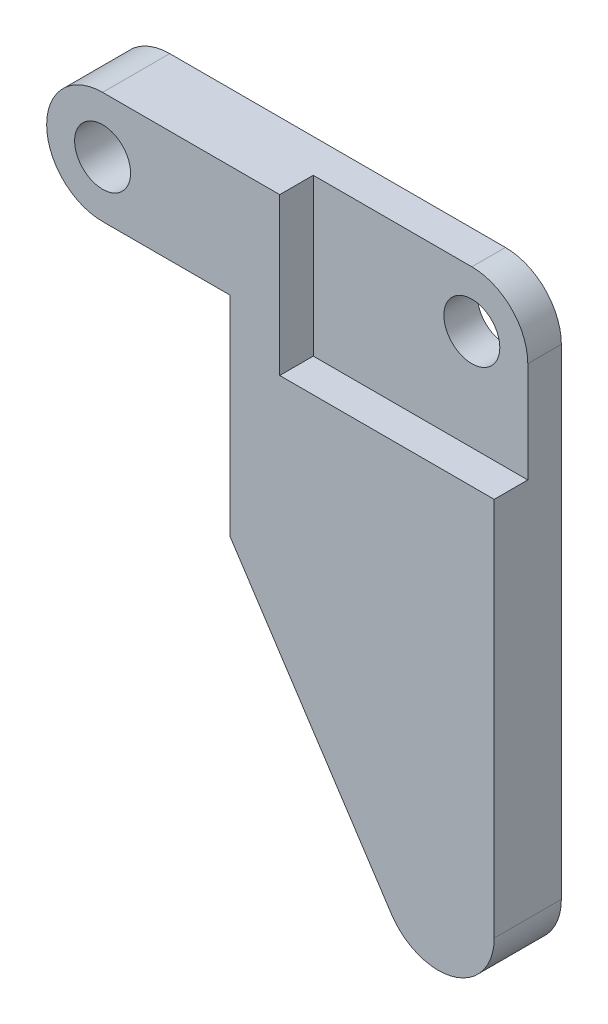
from build123d import *

# Parameters (mm, degrees)
SKETCH1_R               = 2.5
BOSS_EXTRUDE1_DEPTH     = 6
CUT_EXTRUDE1_DEPTH      = 60.673537378
CUT_EXTRUDE1_DEPTH_BACK = 3
SKETCH2_R               = 2.5


with BuildPart() as part:
    # Sketch1 → Boss-Extrude1 (new body)
    # profile 1 of 2: a face of its own
    with BuildSketch(Plane.XY):
        with BuildLine():
            ThreePointArc((30, -5), (35, 0), (30, 5))
            Line((30, 5), (0, 5))
            ThreePointArc((0, 5), (-5, 0), (0, -5))
            Line((0, -5), (30, -5))
        make_face()
        with Locations((30, 0)):
            Circle(SKETCH1_R, mode=Mode.SUBTRACT)
        Circle(SKETCH1_R, mode=Mode.SUBTRACT)
    # profile 2 of 2: a face of its own
    with BuildSketch(Plane.XY):
        with BuildLine():
            Line((35, -42.957596512), (35, 0))
            ThreePointArc((35, 0), (33.535533906, -3.535533906), (30, -5))
            Line((30, -5), (11.394465816, -5))
            Line((11.394465816, -5), (11.394465816, -23.685159648))
            Line((11.394465816, -23.685159648), (25.817798964, -45.697887462))
            ThreePointArc((25.817798964, -45.697887462), (31.429859227, -47.748786613), (35, -42.957596512))
        make_face()
    extrude(amount=BOSS_EXTRUDE1_DEPTH)

    # Sketch2 → Cut-Extrude1 (cut, two sides: drawn at the far end of the back side and taken through both)
    with BuildSketch(Plane.XY.offset(6).offset(-CUT_EXTRUDE1_DEPTH_BACK)):
        with BuildLine():
            Line((30, 5), (15.828754387, 5))
            Line((15.828754387, 5), (15.828754387, -8.999149352))
            Line((15.828754387, -8.999149352), (35, -8.999149352))
            Line((35, -8.999149352), (35, 0))
            ThreePointArc((35, 0), (33.535533906, 3.535533906), (30, 5))
        make_face()
        with Locations((30, 0)):
            Circle(SKETCH2_R, mode=Mode.SUBTRACT)
    extrude(amount=CUT_EXTRUDE1_DEPTH + CUT_EXTRUDE1_DEPTH_BACK, mode=Mode.SUBTRACT)


solid = part.part
